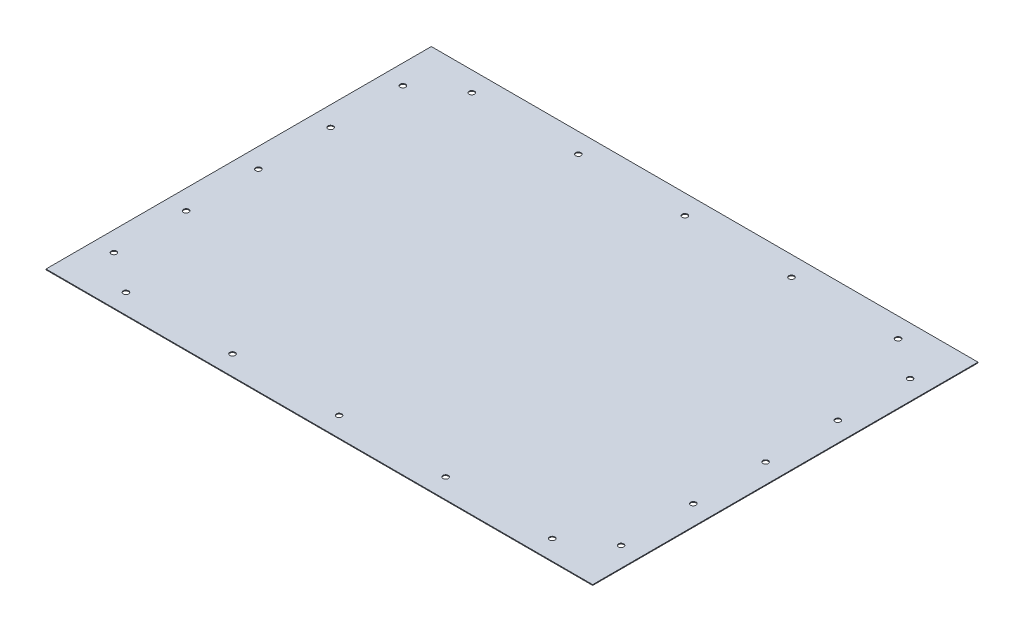
from build123d import *

# Parameters (mm, degrees)
SKETCH1_W               = 454
SKETCH1_H               = 320
BOSS_EXTRUDE1_DEPTH     = 0.635
SKETCH2_R               = 2.248
CUT_EXTRUDE2_DEPTH      = 305.973664639
LPATTERN1_COUNT         = 5
LPATTERN1_PITCH         = 88.5
MIRROR1_COPY_1_SKETCH_R = 2.248
MIRROR1_COPY_1_DEPTH    = 305.973664639
MIRROR1_COPY_2_SKETCH_R = 2.248
MIRROR1_COPY_2_DEPTH    = 305.973664639
MIRROR1_COPY_3_SKETCH_R = 2.248
MIRROR1_COPY_3_DEPTH    = 305.973664639
MIRROR1_COPY_4_SKETCH_R = 2.248
MIRROR1_COPY_4_DEPTH    = 305.973664639
SKETCH3_R               = 2.248
CUT_EXTRUDE3_DEPTH      = 10
LPATTERN2_COUNT         = 5
LPATTERN2_PITCH         = 60
MIRROR2_COPY_1_SKETCH_R = 2.248
MIRROR2_COPY_1_DEPTH    = 10
MIRROR2_COPY_2_SKETCH_R = 2.248
MIRROR2_COPY_2_DEPTH    = 10
MIRROR2_COPY_3_SKETCH_R = 2.248
MIRROR2_COPY_3_DEPTH    = 10
MIRROR2_COPY_4_SKETCH_R = 2.248
MIRROR2_COPY_4_DEPTH    = 10


with BuildPart() as part:
    # Sketch1 → Boss-Extrude1 (new body)
    with BuildSketch(Plane(origin=(0, 0, 0), x_dir=(1, 0, 0), z_dir=(0, 1, 0))):
        with Locations((14.099378882, -26.760869565)):
            Rectangle(SKETCH1_W, SKETCH1_H)
    extrude(amount=BOSS_EXTRUDE1_DEPTH)

    # Sketch2 → Cut-Extrude2 (cut, through all)
    with BuildSketch(Plane(origin=(0, 0.635, 0), x_dir=(1, 0, 0), z_dir=(0, 1, 0))):
        with Locations(Location((-162.900621118, -170.360869565, 0), (0, 0, 270))):
            Circle(SKETCH2_R)
    cut_extrude2 = extrude(amount=-CUT_EXTRUDE2_DEPTH, mode=Mode.SUBTRACT)

    # LPattern1: Cut-Extrude2 ×5
    with Locations(*[(i * LPATTERN1_PITCH, 0, 0) for i in range(1, LPATTERN1_COUNT)]):
        add(cut_extrude2, mode=Mode.SUBTRACT)

    # Mirror1: Cut-Extrude2 across plane
    add(cut_extrude2.mirror(Plane(origin=(0, 0, 26.760869565), x_dir=(1, 0, 0), z_dir=(0, 0, -1))), mode=Mode.SUBTRACT)

    # Mirror1 copy 1 sketch → Mirror1 copy 1 (cut, through all)
    with BuildSketch(Plane(origin=(88.5, 0.635, 53.52173913), x_dir=(1, 0, 0), z_dir=(0, 1, 0))):
        with Locations((-162.900621118, 170.360869565)):
            Circle(MIRROR1_COPY_1_SKETCH_R)
    extrude(amount=-MIRROR1_COPY_1_DEPTH, mode=Mode.SUBTRACT)

    # Mirror1 copy 2 sketch → Mirror1 copy 2 (cut, through all)
    with BuildSketch(Plane(origin=(177, 0.635, 53.52173913), x_dir=(1, 0, 0), z_dir=(0, 1, 0))):
        with Locations((-162.900621118, 170.360869565)):
            Circle(MIRROR1_COPY_2_SKETCH_R)
    extrude(amount=-MIRROR1_COPY_2_DEPTH, mode=Mode.SUBTRACT)

    # Mirror1 copy 3 sketch → Mirror1 copy 3 (cut, through all)
    with BuildSketch(Plane(origin=(265.5, 0.635, 53.52173913), x_dir=(1, 0, 0), z_dir=(0, 1, 0))):
        with Locations((-162.900621118, 170.360869565)):
            Circle(MIRROR1_COPY_3_SKETCH_R)
    extrude(amount=-MIRROR1_COPY_3_DEPTH, mode=Mode.SUBTRACT)

    # Mirror1 copy 4 sketch → Mirror1 copy 4 (cut, through all)
    with BuildSketch(Plane(origin=(354, 0.635, 53.52173913), x_dir=(1, 0, 0), z_dir=(0, 1, 0))):
        with Locations((-162.900621118, 170.360869565)):
            Circle(MIRROR1_COPY_4_SKETCH_R)
    extrude(amount=-MIRROR1_COPY_4_DEPTH, mode=Mode.SUBTRACT)

    # Sketch3 → Cut-Extrude3 (cut)
    with BuildSketch(Plane(origin=(0, 0.635, 0), x_dir=(1, 0, 0), z_dir=(0, 1, 0))):
        with Locations(Location((-196.500621118, -146.760869565, 0), (0, 0, 270))):
            Circle(SKETCH3_R)
    cut_extrude3 = extrude(amount=-CUT_EXTRUDE3_DEPTH, mode=Mode.SUBTRACT)

    # LPattern2: Cut-Extrude3 ×5
    with Locations(*[(0, 0, -i * LPATTERN2_PITCH) for i in range(1, LPATTERN2_COUNT)]):
        add(cut_extrude3, mode=Mode.SUBTRACT)

    # Mirror2: Cut-Extrude3 across plane
    add(cut_extrude3.mirror(Plane.ZY.offset(-14.099378882)), mode=Mode.SUBTRACT)

    # Mirror2 copy 1 sketch → Mirror2 copy 1 (cut)
    with BuildSketch(Plane(origin=(28.198757764, 0.635, -60), x_dir=(-1, 0, 0), z_dir=(0, 1, 0))):
        with Locations((-196.500621118, 146.760869565)):
            Circle(MIRROR2_COPY_1_SKETCH_R)
    extrude(amount=-MIRROR2_COPY_1_DEPTH, mode=Mode.SUBTRACT)

    # Mirror2 copy 2 sketch → Mirror2 copy 2 (cut)
    with BuildSketch(Plane(origin=(28.198757764, 0.635, -120), x_dir=(-1, 0, 0), z_dir=(0, 1, 0))):
        with Locations((-196.500621118, 146.760869565)):
            Circle(MIRROR2_COPY_2_SKETCH_R)
    extrude(amount=-MIRROR2_COPY_2_DEPTH, mode=Mode.SUBTRACT)

    # Mirror2 copy 3 sketch → Mirror2 copy 3 (cut)
    with BuildSketch(Plane(origin=(28.198757764, 0.635, -180), x_dir=(-1, 0, 0), z_dir=(0, 1, 0))):
        with Locations((-196.500621118, 146.760869565)):
            Circle(MIRROR2_COPY_3_SKETCH_R)
    extrude(amount=-MIRROR2_COPY_3_DEPTH, mode=Mode.SUBTRACT)

    # Mirror2 copy 4 sketch → Mirror2 copy 4 (cut)
    with BuildSketch(Plane(origin=(28.198757764, 0.635, -240), x_dir=(-1, 0, 0), z_dir=(0, 1, 0))):
        with Locations((-196.500621118, 146.760869565)):
            Circle(MIRROR2_COPY_4_SKETCH_R)
    extrude(amount=-MIRROR2_COPY_4_DEPTH, mode=Mode.SUBTRACT)


solid = part.part
